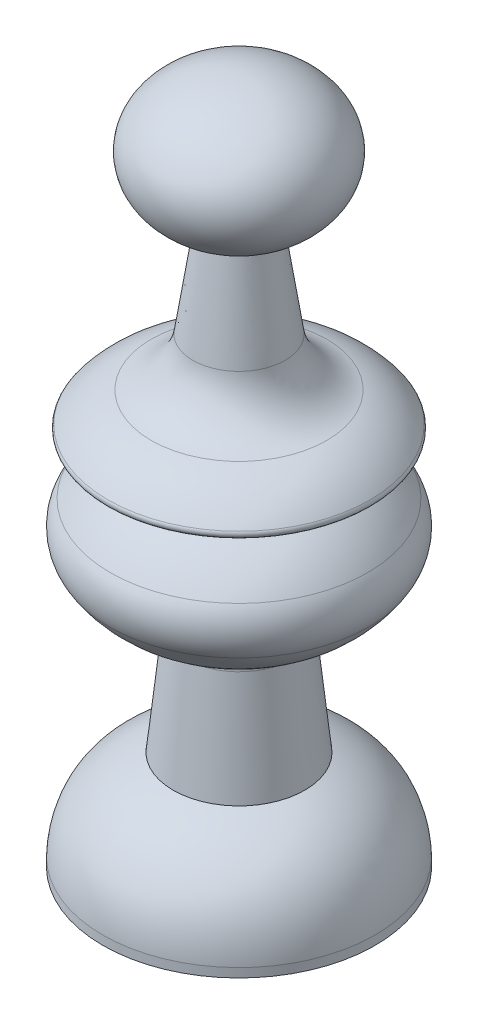
from build123d import *

# Parameters (mm, degrees)
SKETCH2_R           = 11.5
BOSS_EXTRUDE1_DEPTH = 0.762
FILLET3_R           = 0.381
FILLET4_R           = 5.08


with BuildPart() as part:
    # Sketch1 → Revolve2 (revolve)
    with BuildSketch(Plane.XY, mode=Mode.PRIVATE) as revolve2_sk:
        with BuildLine():
            Line((0, 0), (-11.5, 0))
            add(Edge.make_bspline(
                [(-11.5, 0), (-11.220739293, 5.544803256), (-5.55625, 7.617272324)],
                knots=[0, 0, 0, 1, 1, 1], degree=2))
            Line((-5.55625, 7.617272324), (-4.604738833, 16.755049343))
            ThreePointArc((-4.604738833, 16.755049343), (-4.860913091, 17.770740051), (-5.712173428, 18.381156877))
            ThreePointArc((-5.712173428, 18.381156877), (-8.681375024, 19.829117799), (-10.938355217, 22.241334491))
            ThreePointArc((-10.938355217, 22.241334491), (-11.499425433, 24.22332109), (-10.867473973, 26.183858775))
            ThreePointArc((-10.867473973, 26.183858775), (-8.077498361, 28.814719176), (-4.459578874, 30.085958312))
            Line((-4.459578874, 30.085958312), (-4.459578874, 30.988))
            Line((-4.459578874, 30.988), (-11.5, 30.988))
            add(Edge.make_bspline(
                [(-11.5, 30.988), (-9.198161091, 34.54829933), (-4.445, 34.538807228)],
                knots=[0, 0, 0, 1, 1, 1], degree=2))
            Line((-4.445, 34.538807228), (-2.667, 46.388381325))
            add(Edge.make_bspline(
                [(0, 57.15), (-6.247089077, 57.15), (-7.376428709, 52.592998697), (-8.505768341, 48.035997394), (-2.667, 46.388381325)],
                knots=[1.570796327, 1.570796327, 1.570796327, 2.959814679, 2.959814679, 4.348833032, 4.348833032, 4.348833032], degree=2, weights=[1, 0.768367926, 1, 0.768367926, 1]))
            Line((0, 57.15), (0, 0))
        make_face()
    revolve(revolve2_sk.sketch.rotate(Axis((0, 57.15, 0), (0, -1, 0)), 270), axis=Axis((0, 57.15, 0), (0, -1, 0)))

    # Fillet3
    fillet3_edges = [part.edges().sort_by_distance(p)[0] for p in [
        (0, 30.085958312, -4.459578874),
        (0, 30.988, -4.459578874),
        (0, 30.988, -11.5),
    ]]
    fillet(fillet3_edges, radius=FILLET3_R)

    # Fillet4
    fillet4_edges = [part.edges().sort_by_distance(p)[0] for p in [
        (0, 34.538807228, -4.445),
    ]]
    fillet(fillet4_edges, radius=FILLET4_R)


with BuildPart() as body_2:
    # Sketch2 → Boss-Extrude1 (new body)
    with BuildSketch(Plane.XZ):
        with Locations(Location((0, 0, 0), (0, 0, 90))):
            Circle(SKETCH2_R)
    extrude(amount=BOSS_EXTRUDE1_DEPTH)


solid = Compound([part.part, body_2.part])
